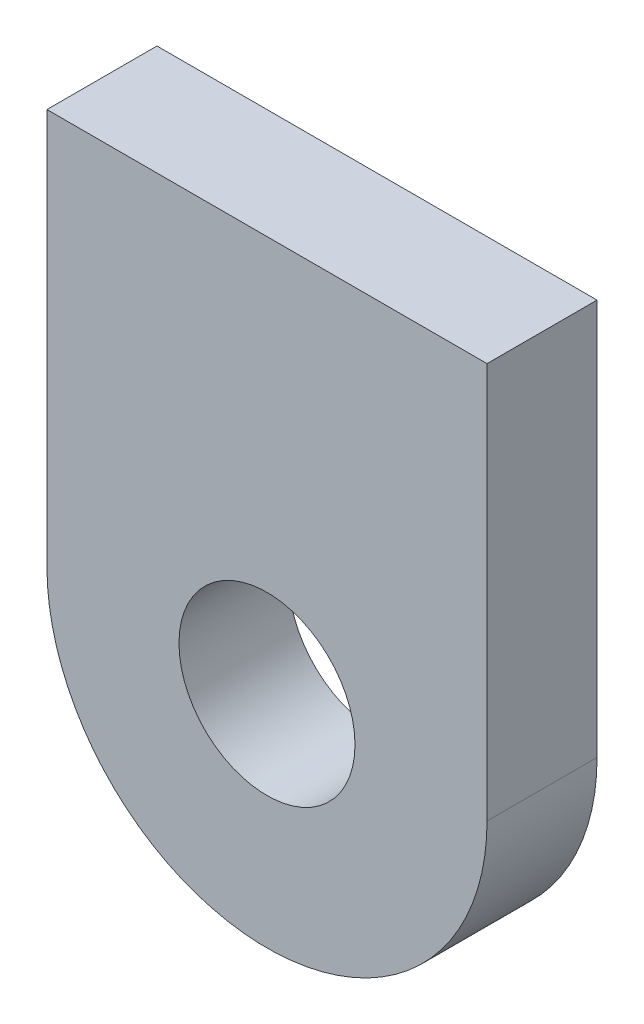
from build123d import *

# Parameters (mm, degrees)
IZIM1_R                     = 4
Y_KSEKLIK_EKSTR_ZYON1_DEPTH = 5


with BuildPart() as part:
    # Çizim1 → Yükseklik-Ekstrüzyon1 (new body)
    with BuildSketch(Plane.XY):
        with BuildLine():
            Line((-10, 15), (-10, 0))
            ThreePointArc((-10, 0), (0, -10), (10, 0))
            Line((10, 0), (10, 15))
            Line((10, 15), (10, 18))
            Line((10, 18), (-10, 18))
            Line((-10, 18), (-10, 15))
        make_face()
        Circle(IZIM1_R, mode=Mode.SUBTRACT)
    extrude(amount=Y_KSEKLIK_EKSTR_ZYON1_DEPTH)


solid = part.part
